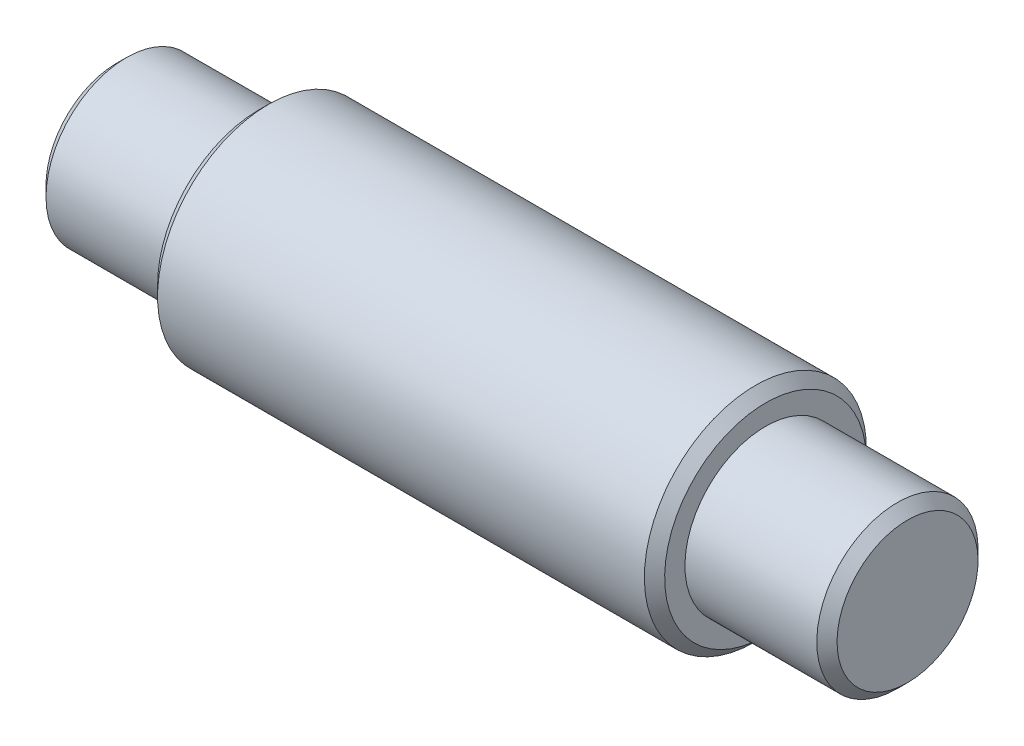
from build123d import *

# Parameters (mm, degrees)
CHANFREIN1_SIZE = 1


with BuildPart() as part:
    # Esquisse1 → Révolution1 (revolve)
    with BuildSketch(Plane.XY, mode=Mode.PRIVATE) as r_volution1_sk:
        Polygon((-39, 0), (-39, 7.95), (-25, 7.95), (-25, 10.95), (25, 10.95), (25, 7.95), (39, 7.95), (39, 0), align=None)
    revolve(r_volution1_sk.sketch.rotate(Axis((-49.116366612, 0, 0), (1, 0, 0)), 180), axis=Axis((-49.116366612, 0, 0), (1, 0, 0)))

    # Chanfrein1
    chanfrein1_edges = [part.edges().sort_by_distance(p)[0] for p in [
        (39, 7.95, 0),
        (25, 10.95, 0),
        (-25, 10.95, 0),
        (-39, 7.95, 0),
    ]]
    chamfer(chanfrein1_edges, length=CHANFREIN1_SIZE)


solid = part.part
